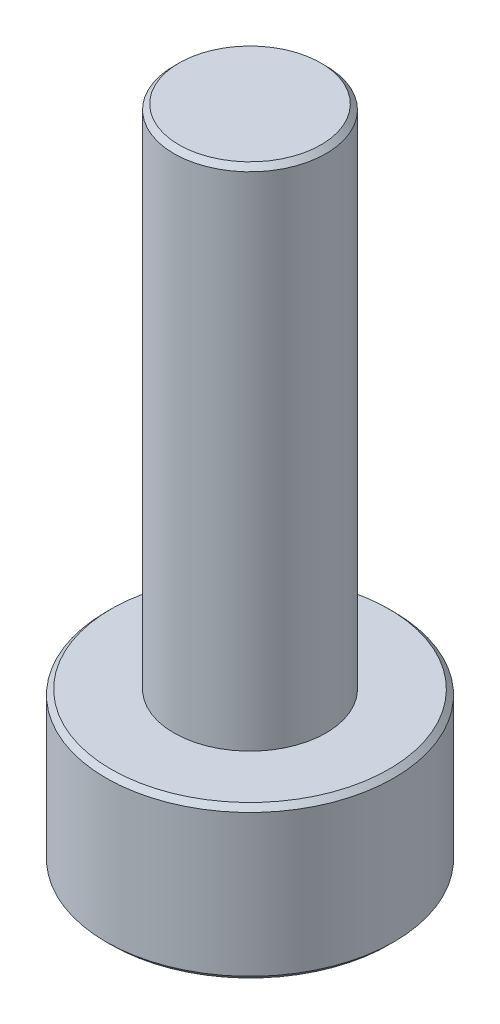
from build123d import *

# Parameters (mm, degrees)
SKETCH_1_R            = 2.84
EXTRUDE_261_DEPTH     = 3
SKETCH_2_R            = 1.5
EXTRUDE_346_DEPTH     = 10
CUT_EXTRUDE_531_DEPTH = 1.3
CHAMFER_593_SIZE      = 0.1


with BuildPart() as part:
    # 草图1 → Extrude 261 (new body)
    with BuildSketch(Plane(origin=(0, 0, 0), x_dir=(1, 0, 0), z_dir=(0, 1, 0))):
        with Locations(Location((0, 0, 0), (0, 0, 270))):
            Circle(SKETCH_1_R)
    extrude(amount=EXTRUDE_261_DEPTH)

    # 草图2 → Extrude 346 (add)
    with BuildSketch(Plane(origin=(0, 3, 0), x_dir=(1, 0, 0), z_dir=(0, 1, 0))):
        with Locations(Location((0, 0, 0), (0, 0, 270))):
            Circle(SKETCH_2_R)
    extrude(amount=EXTRUDE_346_DEPTH)

    # 草图3 → Cut-Extrude 531 (cut)
    with BuildSketch(Plane.XZ):
        Polygon((1.29, -0.744781847), (1.29, 0.744781847), (0, 1.489563695), (-1.29, 0.744781847), (-1.29, -0.744781847), (0, -1.489563695), align=None)
    extrude(amount=-CUT_EXTRUDE_531_DEPTH, mode=Mode.SUBTRACT)

    # Chamfer 593
    chamfer_593_edges = [part.edges().sort_by_distance(p)[0] for p in [
        (0, 0, -2.84),
        (0, 3, -2.84),
        (0, 13, -1.5),
    ]]
    chamfer(chamfer_593_edges, length=CHAMFER_593_SIZE)


solid = part.part
